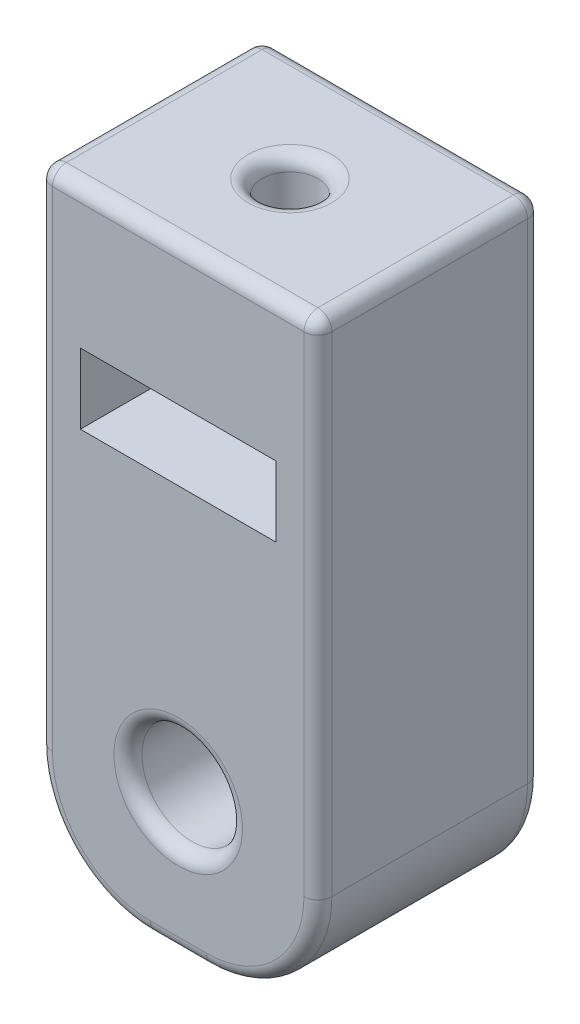
from build123d import *

# Parameters (mm, degrees)
SKETCH1_W           = 12.7
SKETCH1_H           = 27.94
SKETCH1_R           = 2.286
BOSS_EXTRUDE1_DEPTH = 10.16
SKETCH2_R           = 1.27
CUT_EXTRUDE1_DEPTH  = 15.24
FILLET2_R           = 5.08
FILLET1_R           = 0.635
SKETCH3_W           = 8.89
SKETCH3_H           = 3.19532
CUT_EXTRUDE2_DEPTH  = 33.328922036


with BuildPart() as part:
    # Sketch1 → Boss-Extrude1 (new body)
    with BuildSketch(Plane.XY):
        with Locations((6.35, 13.97)):
            Rectangle(SKETCH1_W, SKETCH1_H)
        with Locations((6.35, 6.35)):
            Circle(SKETCH1_R, mode=Mode.SUBTRACT)
    extrude(amount=BOSS_EXTRUDE1_DEPTH)

    # Sketch2 → Cut-Extrude1 (cut)
    with BuildSketch(Plane(origin=(0, 27.94, 0), x_dir=(1, 0, 0), z_dir=(0, 1, 0))):
        with Locations(Location((6.35, -5.08, 0), (0, 0, 270))):
            Circle(SKETCH2_R)
    extrude(amount=-CUT_EXTRUDE1_DEPTH, mode=Mode.SUBTRACT)

    # Fillet2
    fillet2_edges = [part.edges().sort_by_distance(p)[0] for p in [
        (12.7, 0, 5.08),
        (0, 0, 5.08),
    ]]
    fillet(fillet2_edges, radius=FILLET2_R)

    # Fillet1
    fillet1_edges = [part.edges().sort_by_distance(p)[0] for p in [
        (4.064, 6.35, 0),
        (4.064, 6.35, 10.16),
        (6.35, 27.94, 10.16),
        (6.35, 27.94, 3.81),
        (12.7, 16.51, 0),
        (12.7, 16.51, 10.16),
        (6.35, 0, 0),
        (1.487897552, 1.487897552, 0),
        (11.212102448, 1.487897552, 0),
        (6.35, 0, 10.16),
        (1.487897552, 1.487897552, 10.16),
        (11.212102448, 1.487897552, 10.16),
        (0, 16.51, 10.16),
        (6.35, 27.94, 0),
        (0, 16.51, 0),
        (0, 27.94, 5.08),
        (12.7, 27.94, 5.08),
    ]]
    fillet(fillet1_edges, radius=FILLET1_R)

    # Sketch3 → Cut-Extrude2 (cut, through all)
    with BuildSketch(Plane(origin=(0, 0, 0), x_dir=(-1, 0, 0), z_dir=(0, 0, -1))):
        with Locations((-6.35, 19.99234)):
            Rectangle(SKETCH3_W, SKETCH3_H)
    extrude(amount=-CUT_EXTRUDE2_DEPTH, mode=Mode.SUBTRACT)


solid = part.part
